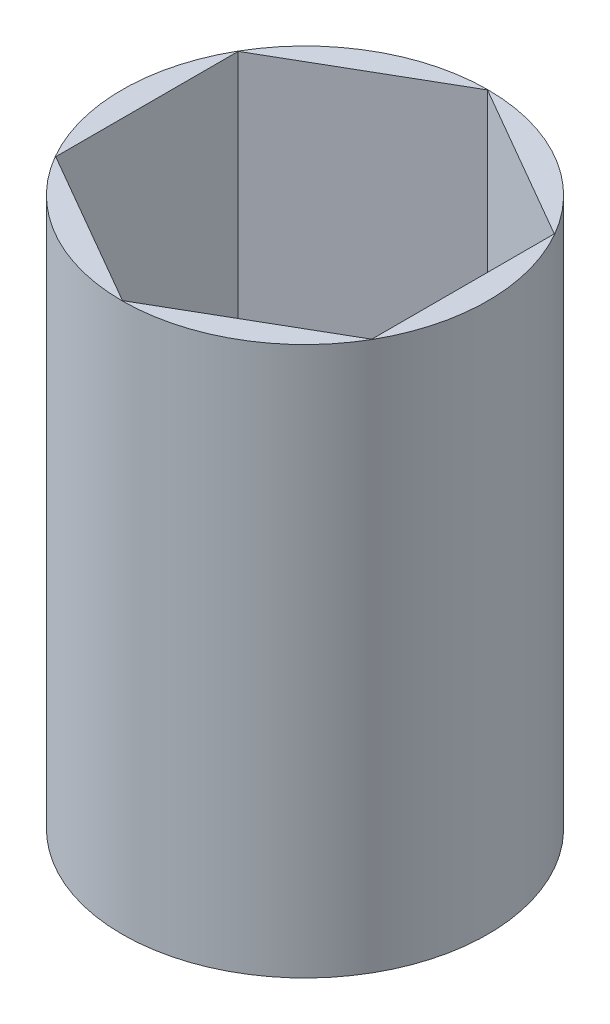
from build123d import *

# Parameters (mm, degrees)
SKETCH1_R           = 7
BOSS_EXTRUDE1_DEPTH = 20
BOSS_EXTRUDE2_START = 1
SKETCH2_R           = 7
SKETCH2_R_2         = 2.05
BOSS_EXTRUDE2_DEPTH = 1


with BuildPart() as part:
    # Sketch1 → Boss-Extrude1 (new body)
    with BuildSketch(Plane(origin=(0, 0, 0), x_dir=(1, 0, 0), z_dir=(0, 1, 0))):
        with Locations(Location((0, 0, 0), (0, 0, 270))):
            Circle(SKETCH1_R)
        Polygon((0, 6.985938257), (-6.05, 3.492969129), (-6.05, -3.492969129), (0, -6.985938257), (6.05, -3.492969129), (6.05, 3.492969129), align=None, mode=Mode.SUBTRACT)
    extrude(amount=BOSS_EXTRUDE1_DEPTH)

    # Sketch2 → Boss-Extrude2 (add)
    with BuildSketch(Plane.XZ.offset(BOSS_EXTRUDE2_START)):
        with Locations(Location((0, 0, 0), (0, 0, 270))):
            Circle(SKETCH2_R)
        with Locations(Location((0, 0, 0), (0, 0, 270))):
            Circle(SKETCH2_R_2, mode=Mode.SUBTRACT)
    extrude(amount=-BOSS_EXTRUDE2_DEPTH)


solid = part.part
